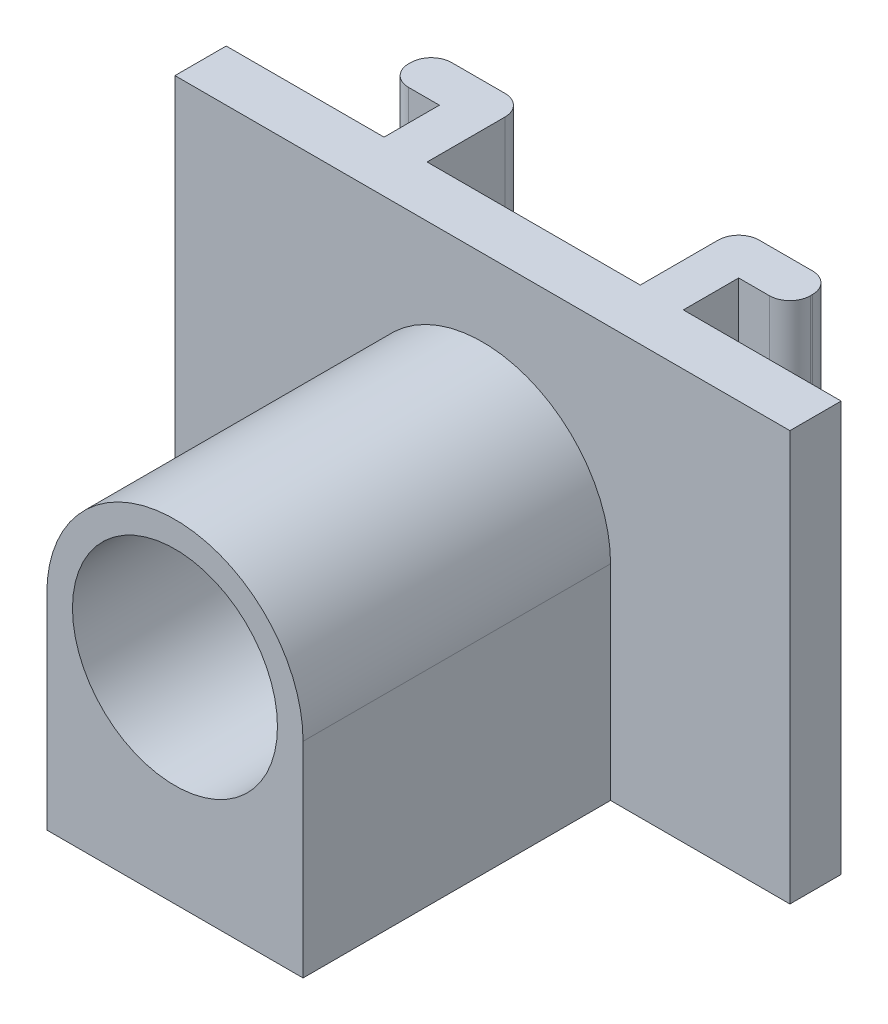
from build123d import *

# Parameters (mm, degrees)
SKETCH1_W           = 38.1
SKETCH1_H           = 25.4
BOSS_EXTRUDE1_DEPTH = 3.175
SKETCH2_W           = 25.4
SKETCH2_H           = 25.4
BOSS_EXTRUDE2_DEPTH = 6.35
CUT_EXTRUDE1_REACH  = 34.379
SKETCH3_W           = 3.175
SKETCH3_H           = 3.175
SKETCH3_W_2         = 6.35
SKETCH3_H_2         = 6.35
CUT_EXTRUDE2_REACH  = 34.379
FILLET1_R           = 1.27
BOSS_EXTRUDE3_DEPTH = 19.05
CUT_EXTRUDE3_REACH  = 38.418
SKETCH6_R           = 6.35


with BuildPart() as part:
    # Sketch1 → Boss-Extrude1 (new body)
    with BuildSketch(Plane.XY):
        Rectangle(SKETCH1_W, SKETCH1_H)
    extrude(amount=BOSS_EXTRUDE1_DEPTH)

    # Sketch2 → Boss-Extrude2 (add)
    with BuildSketch(Plane(origin=(0, 0, 0), x_dir=(-1, 0, 0), z_dir=(0, 0, -1))):
        Rectangle(SKETCH2_W, SKETCH2_H)
    extrude(amount=BOSS_EXTRUDE2_DEPTH)

    # Sketch3 → Cut-Extrude1 (cut, up to next)
    with BuildSketch(Plane(origin=(0, 12.7, 0), x_dir=(1, 0, 0), z_dir=(0, 1, 0)), mode=Mode.PRIVATE) as cut_extrude1_sk1:
        with Locations((11.1125, 1.5875)):
            Rectangle(SKETCH3_W, SKETCH3_H)
    cut_extrude1_tool1 = extrude(cut_extrude1_sk1.sketch, amount=-CUT_EXTRUDE1_REACH, mode=Mode.PRIVATE) & part.part
    # Sketch3 → Cut-Extrude1 (cut, up to next)
    with BuildSketch(Plane(origin=(0, 12.7, 0), x_dir=(1, 0, 0), z_dir=(0, 1, 0)), mode=Mode.PRIVATE) as cut_extrude1_sk2:
        with Locations((3.175, 3.175)):
            Rectangle(SKETCH3_W_2, SKETCH3_H_2)
    cut_extrude1_tool2 = extrude(cut_extrude1_sk2.sketch, amount=-CUT_EXTRUDE1_REACH, mode=Mode.PRIVATE) & part.part
    cut_extrude1_1 = cut_extrude1_tool1.solids().sort_by_distance((11.1125, 12.7, -1.5875))[0]
    add(cut_extrude1_1, mode=Mode.SUBTRACT)
    cut_extrude1_2 = cut_extrude1_tool2.solids().sort_by_distance((3.175, 12.7, -3.175))[0]
    add(cut_extrude1_2, mode=Mode.SUBTRACT)
    cut_extrude1 = cut_extrude1_1 + cut_extrude1_2  # Cut-Extrude1 as one shape, for the pattern or mirror that repeats it

    # Sketch4 → Cut-Extrude2 (cut, up to next)
    with BuildSketch(Plane(origin=(0, 12.7, 0), x_dir=(1, 0, 0), z_dir=(0, 1, 0)), mode=Mode.PRIVATE) as cut_extrude2_sk1:
        Polygon((6.604, 0), (6.35, 0), (6.35, 6.35), (12.7, 6.35), (12.7, 3.175), (9.525, 3.175), (9.525, 0), (9.271, 0), (9.271, 3.429), (12.446, 3.429), (12.446, 6.096), (6.604, 6.096), align=None)
    cut_extrude2_tool1 = extrude(cut_extrude2_sk1.sketch, amount=-CUT_EXTRUDE2_REACH, mode=Mode.PRIVATE) & part.part
    cut_extrude2 = cut_extrude2_tool1.solids().sort_by_distance((6.477, 12.7, -0.089803))[0]
    add(cut_extrude2, mode=Mode.SUBTRACT)

    # Mirror1: Cut-Extrude1, Cut-Extrude2 across plane
    add(cut_extrude1.mirror(Plane.ZY), mode=Mode.SUBTRACT)
    add(cut_extrude2.mirror(Plane.ZY), mode=Mode.SUBTRACT)

    # Fillet1
    fillet1_edges = [part.edges().sort_by_distance(p)[0] for p in [
        (-6.604, 0, -6.096),
        (-12.446, 0, -6.096),
        (-12.446, 0, -3.429),
        (12.446, 0, -3.429),
        (12.446, 0, -6.096),
        (6.604, 0, -6.096),
    ]]
    fillet(fillet1_edges, radius=FILLET1_R)

    # Sketch5 → Boss-Extrude3 (add)
    with BuildSketch(Plane.XY.offset(3.175)):
        with BuildLine():
            Line((7.9375, 0), (7.9375, -12.7))
            Line((7.9375, -12.7), (-7.9375, -12.7))
            Line((-7.9375, -12.7), (-7.9375, 0))
            ThreePointArc((-7.9375, 0), (0, 7.9375), (7.9375, 0))
        make_face()
    extrude(amount=BOSS_EXTRUDE3_DEPTH)

    # Sketch6 → Cut-Extrude3 (cut, up to next)
    with BuildSketch(Plane.XY.offset(22.225), mode=Mode.PRIVATE) as cut_extrude3_sk1:
        Circle(SKETCH6_R)
    cut_extrude3_tool1 = extrude(cut_extrude3_sk1.sketch, amount=-CUT_EXTRUDE3_REACH, mode=Mode.PRIVATE) & part.part
    add(cut_extrude3_tool1.solids().sort_by_distance((0, 0, 22.225))[0], mode=Mode.SUBTRACT)


solid = part.part
